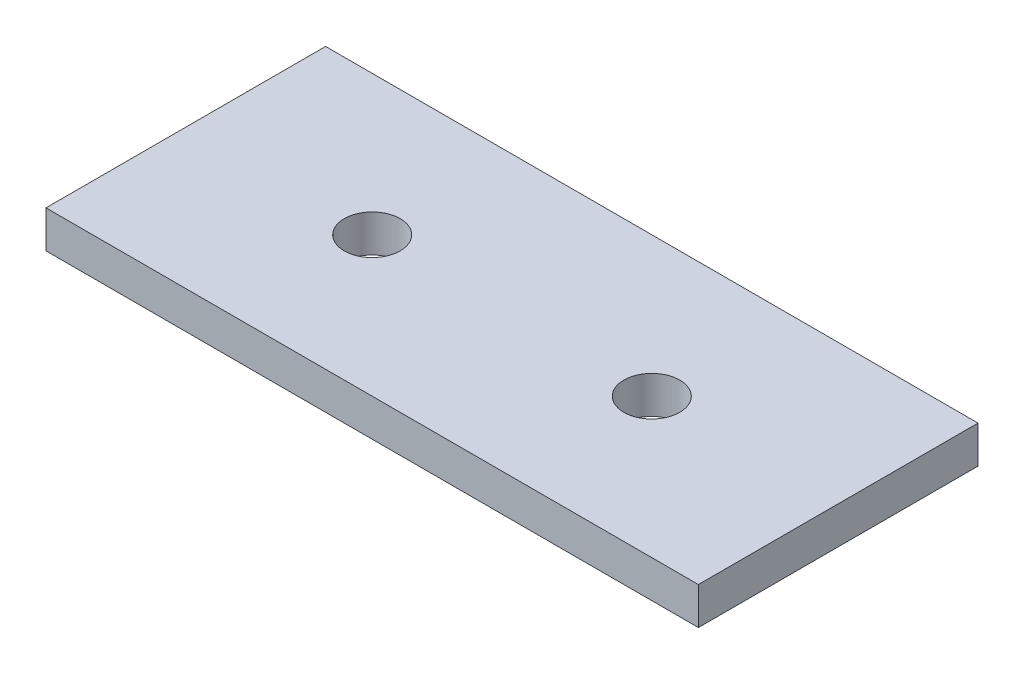
from build123d import *

# Parameters (mm, degrees)
BOSS_EXTRUDE1_DEPTH = 2


with BuildPart() as part:
    # Sketch1 → Boss-Extrude1 (new body)
    with BuildSketch(Plane(origin=(0, 0, 0), x_dir=(1, 0, 0), z_dir=(0, 1, 0))):
        with BuildLine():
            Line((35, 7.5), (26.5, 7.5))
            ThreePointArc((26.5, 7.5), (25, 6), (23.5, 7.5))
            Line((23.5, 7.5), (11.5, 7.5))
            ThreePointArc((11.5, 7.5), (10, 6), (8.5, 7.5))
            Line((8.5, 7.5), (0, 7.5))
            Line((0, 7.5), (0, 0))
            Line((0, 0), (35, 0))
            Line((35, 0), (35, 7.5))
        make_face()
        with BuildLine():
            ThreePointArc((23.5, 7.5), (25, 9), (26.5, 7.5))
            Line((26.5, 7.5), (35, 7.5))
            Line((35, 7.5), (35, 15))
            Line((35, 15), (0, 15))
            Line((0, 15), (0, 7.5))
            Line((0, 7.5), (8.5, 7.5))
            ThreePointArc((8.5, 7.5), (10, 9), (11.5, 7.5))
            Line((11.5, 7.5), (23.5, 7.5))
        make_face()
    extrude(amount=BOSS_EXTRUDE1_DEPTH)


solid = part.part
